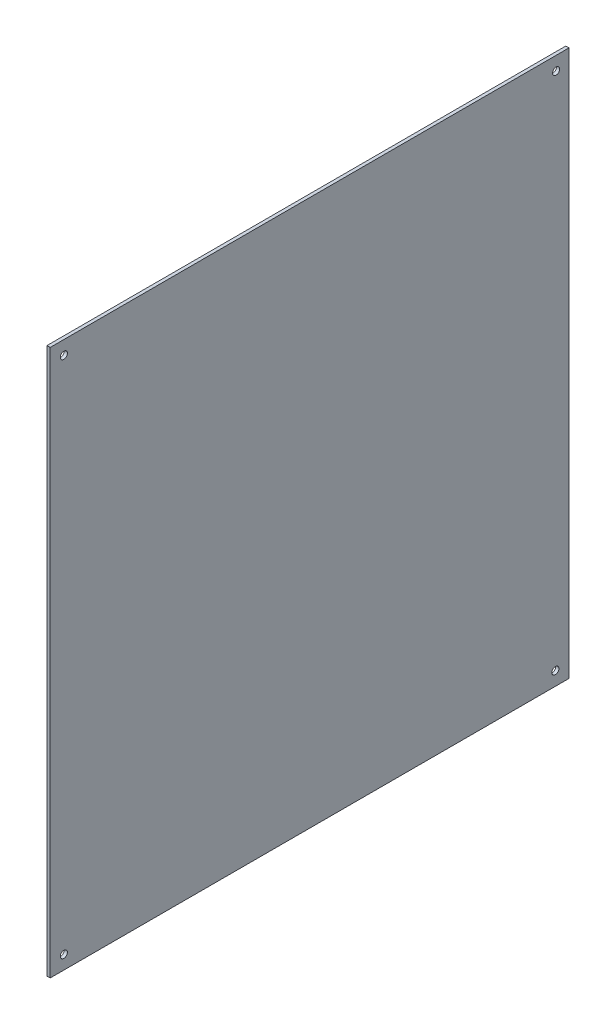
from build123d import *

# Parameters (mm, degrees)
SKETCH1_W           = 482.6
SKETCH1_H           = 508
BOSS_EXTRUDE1_DEPTH = 3
SKETCH2_R           = 3.295
CUT_EXTRUDE1_DEPTH  = 3


with BuildPart() as part:
    # Sketch1 → Boss-Extrude1 (new body)
    with BuildSketch(Plane(origin=(0, 0, 0), x_dir=(0, 0, -1), z_dir=(1, 0, 0))):
        with Locations((762.824184205, -254)):
            Rectangle(SKETCH1_W, SKETCH1_H)
    extrude(amount=BOSS_EXTRUDE1_DEPTH)

    # Sketch2 → Cut-Extrude1 (cut)
    with BuildSketch(Plane(origin=(3, 0, 0), x_dir=(0, 0, -1), z_dir=(1, 0, 0))):
        with Locations((992.124184205, -12.7)):
            Circle(SKETCH2_R)
        with Locations((534.224184205, -12.7)):
            Circle(SKETCH2_R)
        with Locations((534.224184205, -495.3)):
            Circle(SKETCH2_R)
        with Locations((991.424184205, -495.3)):
            Circle(SKETCH2_R)
    extrude(amount=-CUT_EXTRUDE1_DEPTH, mode=Mode.SUBTRACT)


solid = part.part
